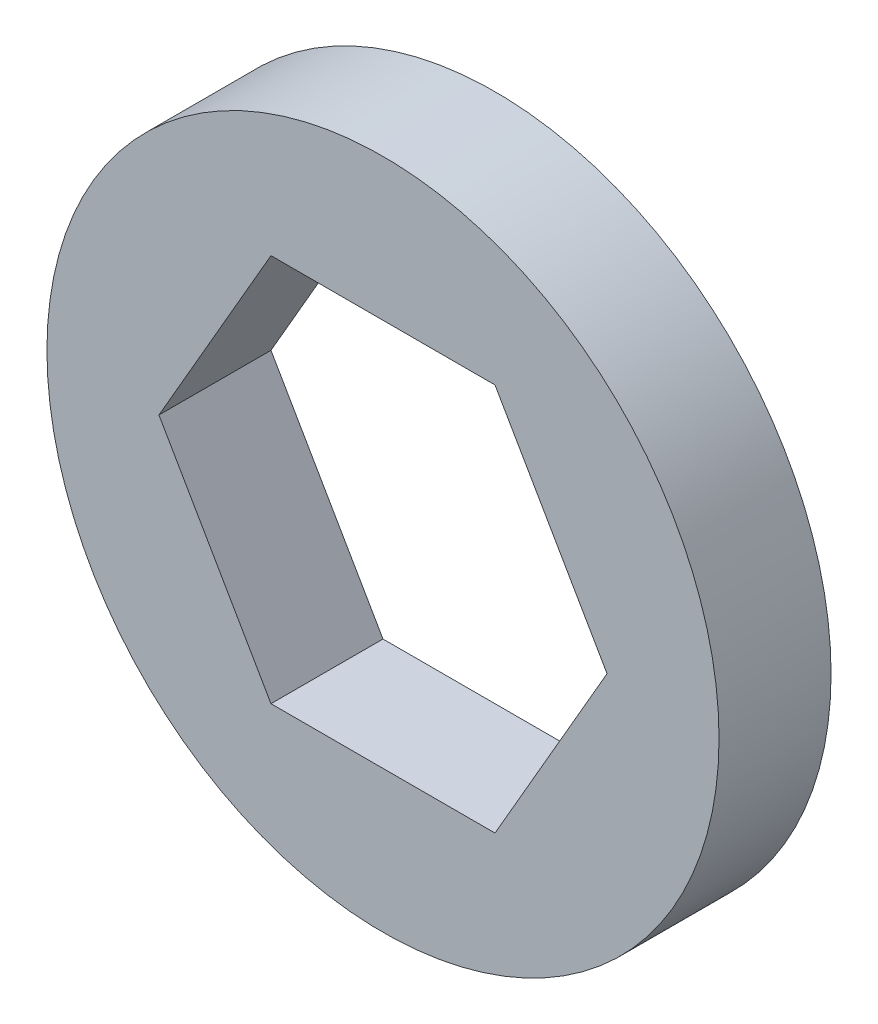
from build123d import *

# Parameters (mm, degrees)
SKETCH1_R           = 9.525
BOSS_EXTRUDE1_DEPTH = 3.175


with BuildPart() as part:
    # Sketch1 → Boss-Extrude1 (new body)
    with BuildSketch(Plane.XY):
        Circle(SKETCH1_R)
        Polygon((-3.175, 5.499261314), (-6.35, 0), (-3.175, -5.499261314), (3.175, -5.499261314), (6.35, 0), (3.175, 5.499261314), align=None, mode=Mode.SUBTRACT)
    extrude(amount=BOSS_EXTRUDE1_DEPTH)


solid = part.part
